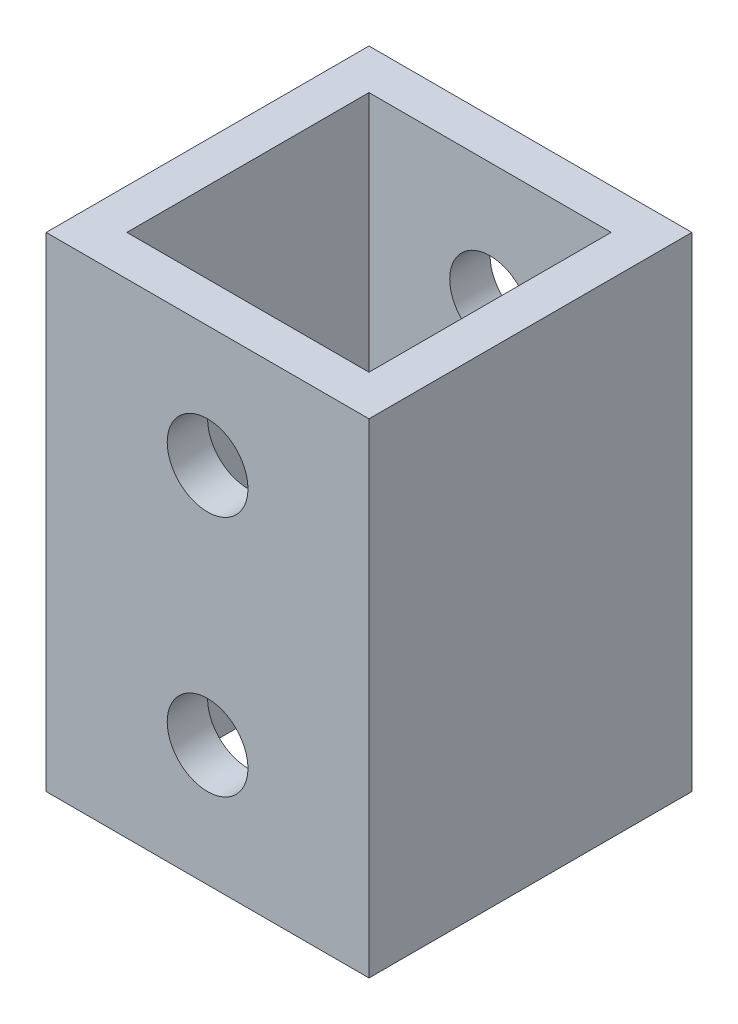
from build123d import *

# Parameters (mm, degrees)
SKETCH1_W           = 25.4
SKETCH1_H           = 25.4
SKETCH1_W_2         = 19.05
SKETCH1_H_2         = 19.05
BOSS_EXTRUDE1_DEPTH = 38.1
SKETCH2_R           = 3.175
CUT_EXTRUDE1_DEPTH  = 25.4


with BuildPart() as part:
    # Sketch1 → Boss-Extrude1 (new body)
    with BuildSketch(Plane(origin=(0, 0, 0), x_dir=(1, 0, 0), z_dir=(0, 1, 0))):
        Rectangle(SKETCH1_W, SKETCH1_H)
        Rectangle(SKETCH1_W_2, SKETCH1_H_2, mode=Mode.SUBTRACT)
    extrude(amount=BOSS_EXTRUDE1_DEPTH)

    # Sketch2 → Cut-Extrude1 (cut)
    with BuildSketch(Plane(origin=(0, 0, -12.7), x_dir=(-1, 0, 0), z_dir=(0, 0, -1))):
        with Locations((0, 28.575)):
            Circle(SKETCH2_R)
        with Locations((0, 9.525)):
            Circle(SKETCH2_R)
    extrude(amount=-CUT_EXTRUDE1_DEPTH, mode=Mode.SUBTRACT)


solid = part.part
